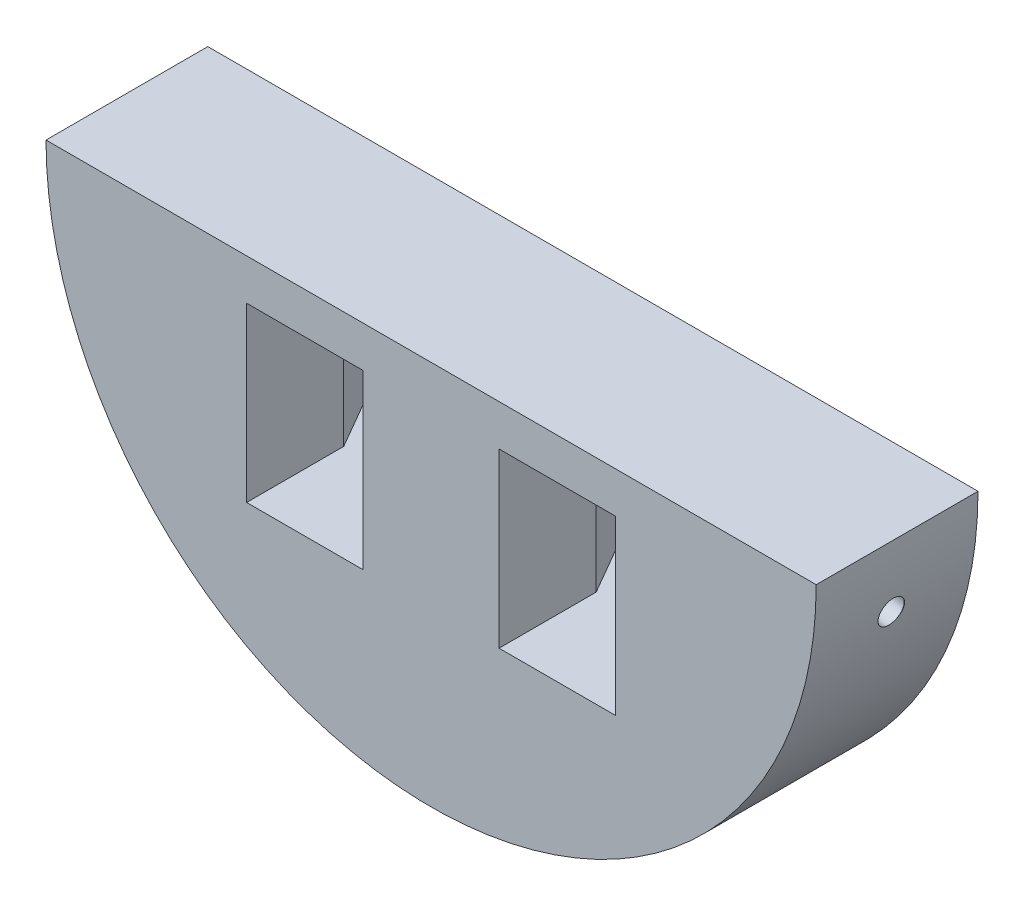
from build123d import *
from OCP.BRepFilletAPI import BRepFilletAPI_MakeChamfer

# Parameters (mm, degrees)
SKETCH1_W           = 18
SKETCH1_H           = 18
BOSS_EXTRUDE1_DEPTH = 25
CIRPATTERN1_COUNT   = 5
CIRPATTERN1_ANGLE   = 160
CHAMFER1_SIZE       = 15
CHAMFER1_SIZE2      = 8.660254038
CHAMFER2_SIZE       = 10
CHAMFER2_SIZE2      = 5.773502692
CHAMFER3_SIZE       = 4
CHAMFER3_SIZE2      = 6.92820323


with BuildPart() as part:
    # Sketch1 → Boss-Extrude1 (new body)
    with BuildSketch(Plane.XY):
        with BuildLine():
            Line((-119, 0), (0, 0))
            ThreePointArc((0, 0), (-59.5, -59.5), (-119, 0))
        make_face()
        with Locations((-40, -24)):
            Rectangle(SKETCH1_W, SKETCH1_H, mode=Mode.SUBTRACT)
        with Locations((-79, -24)):
            Rectangle(SKETCH1_W, SKETCH1_H, mode=Mode.SUBTRACT)
    extrude(amount=BOSS_EXTRUDE1_DEPTH)

    # Sketch4 → Ø4.0mm Dowel Hole2 (revolve, cut)
    with BuildSketch(Plane(origin=(-0.903938696, -10.332066571, 12.5), x_dir=(0.1736481776669305, 0.9848077530122081, 0), z_dir=(0, 0, 1))):
        Polygon((0, 0), (0, 11.201721238), (2, 10), (2, 0.025), (2.025, 0), align=None)
    f_4_0mm_dowel_hole2 = revolve(axis=Axis((5.349590536, -11.434732499, 12.5), (-0.9848077530122081, 0.1736481776669305, 0)), mode=Mode.SUBTRACT)

    # CirPattern1: Ø4.0mm Dowel Hole2 ×5 about axis
    cirpattern1_axis = Axis((-59.5, 0, 0), (0, 0, -1))
    for i in range(1, CIRPATTERN1_COUNT):
        add(f_4_0mm_dowel_hole2.rotate(cirpattern1_axis, i * CIRPATTERN1_ANGLE / (CIRPATTERN1_COUNT - 1)), mode=Mode.SUBTRACT)

    # Chamfer1: one chamfer whose edges measure the first distance from different faces: ONE call of the kernel's chamfer builder (chamfer() names one face for all edges)
    chamfer1_edges_1 = [part.edges().sort_by_distance(p)[0] for p in [
        (-40, -15, 25),
    ]]
    chamfer1_side_1 = [part.faces().sort_by_distance(p)[0] for p in [
        (-40, -15, 12.5),
    ]]
    chamfer1_edges_2 = [part.edges().sort_by_distance(p)[0] for p in [
        (-79, -15, 25),
    ]]
    chamfer1_side_2 = [part.faces().sort_by_distance(p)[0] for p in [
        (-79, -15, 12.5),
    ]]
    chamfer1 = BRepFilletAPI_MakeChamfer(part.part.solid().wrapped)
    for e in chamfer1_edges_1:
        chamfer1.Add(CHAMFER1_SIZE, CHAMFER1_SIZE2, e.wrapped, chamfer1_side_1[0].wrapped)  # the first distance lies on this face
    for e in chamfer1_edges_2:
        chamfer1.Add(CHAMFER1_SIZE, CHAMFER1_SIZE2, e.wrapped, chamfer1_side_2[0].wrapped)  # the first distance lies on this face
    add(Compound.cast(chamfer1.Shape()), mode=Mode.REPLACE)

    # Chamfer2: one chamfer whose edges measure the first distance from different faces: ONE call of the kernel's chamfer builder (chamfer() names one face for all edges)
    chamfer2_edges_1 = [part.edges().sort_by_distance(p)[0] for p in [
        (-49, -24, 0),
    ]]
    chamfer2_side_1 = [part.faces().sort_by_distance(p)[0] for p in [
        (-49, -22.500700474, 13.445989877),
    ]]
    chamfer2_edges_2 = [part.edges().sort_by_distance(p)[0] for p in [
        (-31, -24, 0),
    ]]
    chamfer2_side_2 = [part.faces().sort_by_distance(p)[0] for p in [
        (-31, -22.500700474, 13.445989877),
    ]]
    chamfer2_edges_3 = [part.edges().sort_by_distance(p)[0] for p in [
        (-88, -24, 0),
    ]]
    chamfer2_side_3 = [part.faces().sort_by_distance(p)[0] for p in [
        (-88, -22.500700474, 13.445989877),
    ]]
    chamfer2_edges_4 = [part.edges().sort_by_distance(p)[0] for p in [
        (-70, -24, 0),
    ]]
    chamfer2_side_4 = [part.faces().sort_by_distance(p)[0] for p in [
        (-70, -22.500700474, 13.445989877),
    ]]
    chamfer2 = BRepFilletAPI_MakeChamfer(part.part.solid().wrapped)
    for e in chamfer2_edges_1:
        chamfer2.Add(CHAMFER2_SIZE, CHAMFER2_SIZE2, e.wrapped, chamfer2_side_1[0].wrapped)  # the first distance lies on this face
    for e in chamfer2_edges_2:
        chamfer2.Add(CHAMFER2_SIZE, CHAMFER2_SIZE2, e.wrapped, chamfer2_side_2[0].wrapped)  # the first distance lies on this face
    for e in chamfer2_edges_3:
        chamfer2.Add(CHAMFER2_SIZE, CHAMFER2_SIZE2, e.wrapped, chamfer2_side_3[0].wrapped)  # the first distance lies on this face
    for e in chamfer2_edges_4:
        chamfer2.Add(CHAMFER2_SIZE, CHAMFER2_SIZE2, e.wrapped, chamfer2_side_4[0].wrapped)  # the first distance lies on this face
    add(Compound.cast(chamfer2.Shape()), mode=Mode.REPLACE)

    # Chamfer3
    chamfer3_edges = [part.edges().sort_by_distance(p)[0] for p in [
        (-40, -15, 0),
        (-79, -15, 0),
    ]]
    chamfer3_side = [part.faces().sort_by_distance(p)[0] for p in [
        (-59.5, -25.548841696, 0),
    ]]
    chamfer(chamfer3_edges, length=CHAMFER3_SIZE, length2=CHAMFER3_SIZE2, reference=chamfer3_side[0])


solid = part.part
